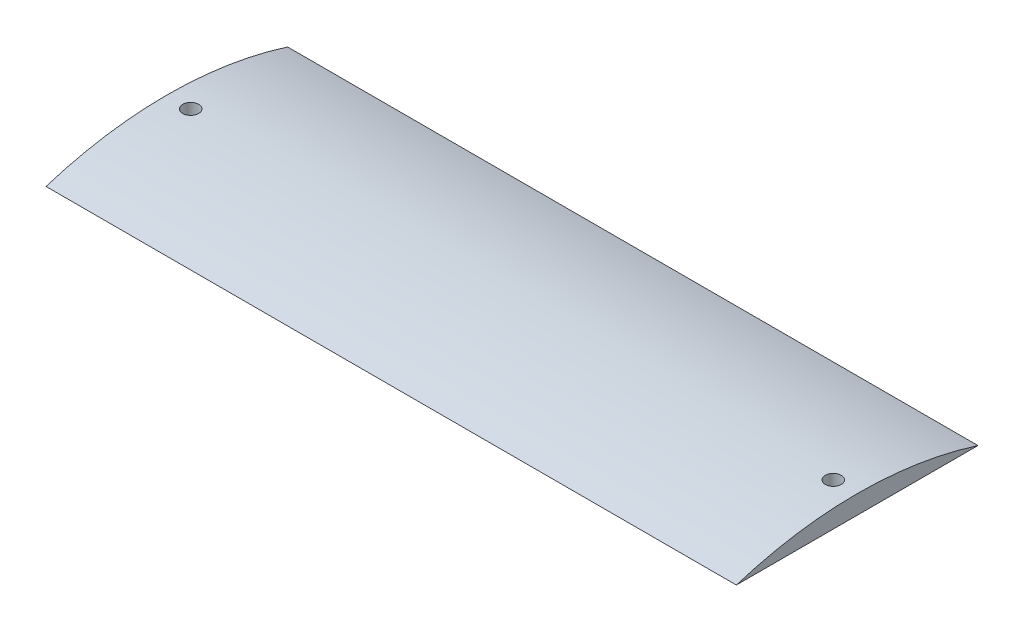
from build123d import *

# Parameters (mm, degrees)
BOSS_EXTRUDE1_DEPTH     = 130
CUT_EXTRUDE1_REACH      = 134.023
CUT_EXTRUDE1_END_RADIUS = 75.021791979
SKETCH2_R               = 1.5


with BuildPart() as part:
    # Sketch1 → Boss-Extrude1 (new body)
    with BuildSketch(Plane(origin=(0, 0, 0), x_dir=(0, 0, -1), z_dir=(1, 0, 0))):
        with BuildLine():
            Line((-22.75, -1), (22.75, -1))
            ThreePointArc((22.75, -1), (0, 2.5325846), (-22.75, -1))
        make_face()
    extrude(amount=BOSS_EXTRUDE1_DEPTH)

    # Cut-Extrude1: up to this cylinder (the profile starts inside it)
    cut_extrude1_end = Plane(origin=(65, -72.489207379, 0), z_dir=(-1, 0, 0)) * Cylinder(CUT_EXTRUDE1_END_RADIUS, 540.089583957, mode=Mode.PRIVATE)
    # Sketch2 → Cut-Extrude1 (cut, up to the surface)
    with BuildSketch(Plane(origin=(0, -1, 0), x_dir=(-1, 0, 0), z_dir=(0, -1, 0)), mode=Mode.PRIVATE) as cut_extrude1_sk1:
        with Locations(Location((-4.5, 0, 0), (0, 0, 90))):
            Circle(SKETCH2_R)
    cut_extrude1_tool1 = extrude(cut_extrude1_sk1.sketch, amount=-CUT_EXTRUDE1_REACH, mode=Mode.PRIVATE) & cut_extrude1_end
    add(cut_extrude1_tool1.solids().sort_by_distance((4.5, -1, 0))[0], mode=Mode.SUBTRACT)
    # Sketch2 → Cut-Extrude1 (cut, up to the surface)
    with BuildSketch(Plane(origin=(0, -1, 0), x_dir=(-1, 0, 0), z_dir=(0, -1, 0)), mode=Mode.PRIVATE) as cut_extrude1_sk2:
        with Locations(Location((-125.5, 0, 0), (0, 0, 90))):
            Circle(SKETCH2_R)
    cut_extrude1_tool2 = extrude(cut_extrude1_sk2.sketch, amount=-CUT_EXTRUDE1_REACH, mode=Mode.PRIVATE) & cut_extrude1_end
    add(cut_extrude1_tool2.solids().sort_by_distance((125.5, -1, 0))[0], mode=Mode.SUBTRACT)


solid = part.part
